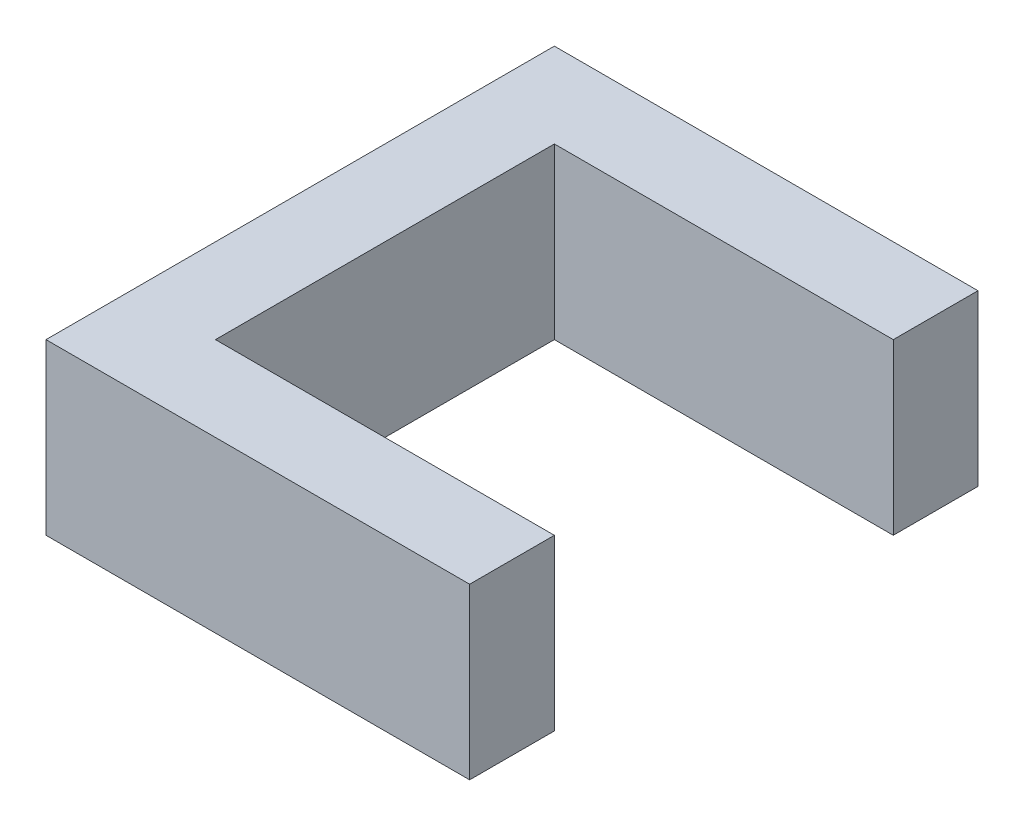
from build123d import *

# Parameters (mm, degrees)
BOSS_EXTRUDE1_DEPTH = 20


with BuildPart() as part:
    # Sketch1 → Boss-Extrude1 (new body)
    with BuildSketch(Plane(origin=(0, 0, 0), x_dir=(1, 0, 0), z_dir=(0, 1, 0))):
        Polygon((0, 0), (0, -60), (50, -60), (50, -50), (10, -50), (10, -10), (50, -10), (50, 0), align=None)
    extrude(amount=BOSS_EXTRUDE1_DEPTH)


solid = part.part
